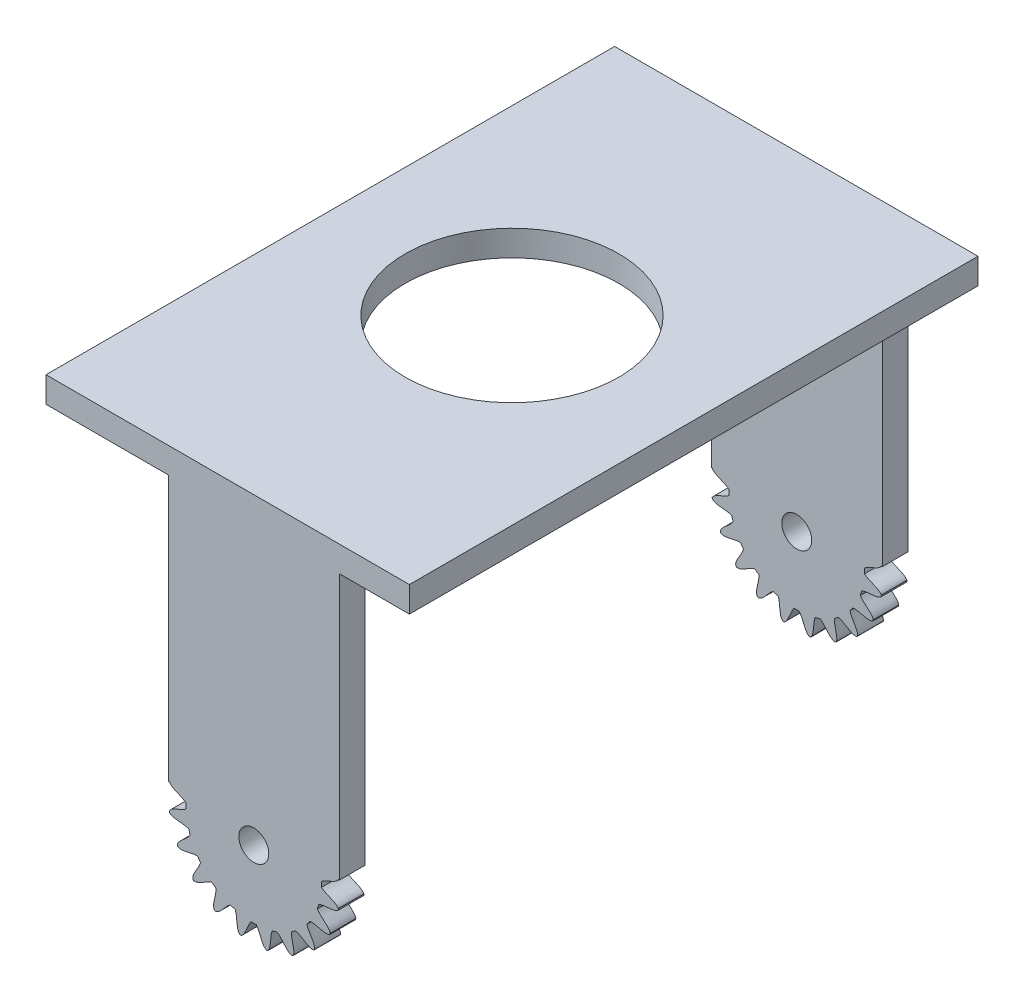
from build123d import *

# Parameters (mm, degrees)
BOSS_EXTRU_1_DEPTH           = 6
ESQUISSE2_R                  = 3.5
ENL_V_MAT_EXTRU_1_DEPTH      = 6
ESQUISSE3_W                  = 85
ESQUISSE3_H                  = 133
BOSS_EXTRU_2_DEPTH           = 6
ENL_V_MAT_EXTRU_10_DEPTH     = 152.368633225
R_P_TITION_CIRCULAIRE5_COUNT = 6
R_P_TITION_CIRCULAIRE5_ANGLE = 90
R_P_TITION_CIRCULAIRE7_COUNT = 6
R_P_TITION_CIRCULAIRE7_ANGLE = 90
ESQUISSE9_R                  = 25
ENL_V_MAT_EXTRU_11_DEPTH     = 167.545083783


with BuildPart() as part:
    # Esquisse1 → Boss.-Extru.1 (new body)
    with BuildSketch(Plane.XY):
        with BuildLine():
            Line((-13.893551657, 26.543066071), (26.106448343, 26.543066071))
            Line((26.106448343, 26.543066071), (26.106448343, -38.456933929))
            ThreePointArc((26.106448343, -38.456933929), (6.106448343, -58.456933929), (-13.893551657, -38.456933929))
            Line((-13.893551657, -38.456933929), (-13.893551657, 26.543066071))
        make_face()
    boss_extru_1 = extrude(amount=BOSS_EXTRU_1_DEPTH)

    # Esquisse2 → Enlèv. mat.-Extru.1 (cut)
    with BuildSketch(Plane.XY.offset(6)):
        with Locations((6.106448343, -38.456933929)):
            Circle(ESQUISSE2_R)
    enl_v_mat_extru_1 = extrude(amount=-ENL_V_MAT_EXTRU_1_DEPTH, mode=Mode.SUBTRACT)

    # Esquisse3 → Boss.-Extru.2 (add)
    with BuildSketch(Plane(origin=(0, 26.543066071, 0), x_dir=(1, 0, 0), z_dir=(0, 1, 0))):
        with Locations((0, -66.5)):
            Rectangle(ESQUISSE3_W, ESQUISSE3_H)
    extrude(amount=BOSS_EXTRU_2_DEPTH)

    # Symétrie1: Boss.-Extru.1, Enlèv. mat.-Extru.1 across plane
    add(boss_extru_1.mirror(Plane(origin=(0, 0, 66.5), x_dir=(1, 0, 0), z_dir=(0, 0, -1))))
    add(enl_v_mat_extru_1.mirror(Plane(origin=(0, 0, 66.5), x_dir=(1, 0, 0), z_dir=(0, 0, -1))), mode=Mode.SUBTRACT)

    # Esquisse8 → Enlèv. mat.-Extru.10 (cut, through all)
    with BuildSketch(Plane(origin=(0, 0, 0), x_dir=(-1, 0, 0), z_dir=(0, 0, -1))):
        with BuildLine():
            Line((-6.677875057, -54.277429421), (-5.477875057, -54.277429421))
            add(Edge.make_bspline(
                [(-5.477875057, -54.277429421), (-4.452691625, -55.595211741), (-4.145284733, -57.755599066), (-3.129134173, -58.198908296)],
                knots=[0, 0, 0, 0, 1, 1, 1, 1], degree=3))
            ThreePointArc((-3.129134173, -58.198908296), (-6.077875057, -61.227215578), (-9.026615942, -58.198908296))
            add(Edge.make_bspline(
                [(-6.677875057, -54.277429421), (-7.70305849, -55.595211741), (-8.010465382, -57.755599066), (-9.026615942, -58.198908296)],
                knots=[0, 0, 0, 0, 1, 1, 1, 1], degree=3))
        make_face()
    enl_v_mat_extru_10 = extrude(amount=-ENL_V_MAT_EXTRU_10_DEPTH, mode=Mode.SUBTRACT)

    # Répétition circulaire5: Enlèv. mat.-Extru.10 ×6 about axis
    r_p_tition_circulaire5_axis = Axis((6.106448343, -38.456933929, 0), (0, 0, 1))
    for i in range(1, R_P_TITION_CIRCULAIRE5_COUNT):
        add(enl_v_mat_extru_10.rotate(r_p_tition_circulaire5_axis, i * R_P_TITION_CIRCULAIRE5_ANGLE / (R_P_TITION_CIRCULAIRE5_COUNT - 1)), mode=Mode.SUBTRACT)

    # Répétition circulaire7: Enlèv. mat.-Extru.10 ×6 about axis
    r_p_tition_circulaire7_axis = Axis((6.106448343, -38.456933929, 0), (0, 0, -1))
    for i in range(1, R_P_TITION_CIRCULAIRE7_COUNT):
        add(enl_v_mat_extru_10.rotate(r_p_tition_circulaire7_axis, i * R_P_TITION_CIRCULAIRE7_ANGLE / (R_P_TITION_CIRCULAIRE7_COUNT - 1)), mode=Mode.SUBTRACT)

    # Esquisse9 → Enlèv. mat.-Extru.11 (cut, through all)
    with BuildSketch(Plane(origin=(0, 32.543066071, 0), x_dir=(1, 0, 0), z_dir=(0, 1, 0))):
        with Locations((0, -66.5)):
            Circle(ESQUISSE9_R)
    extrude(amount=-ENL_V_MAT_EXTRU_11_DEPTH, mode=Mode.SUBTRACT)


solid = part.part
